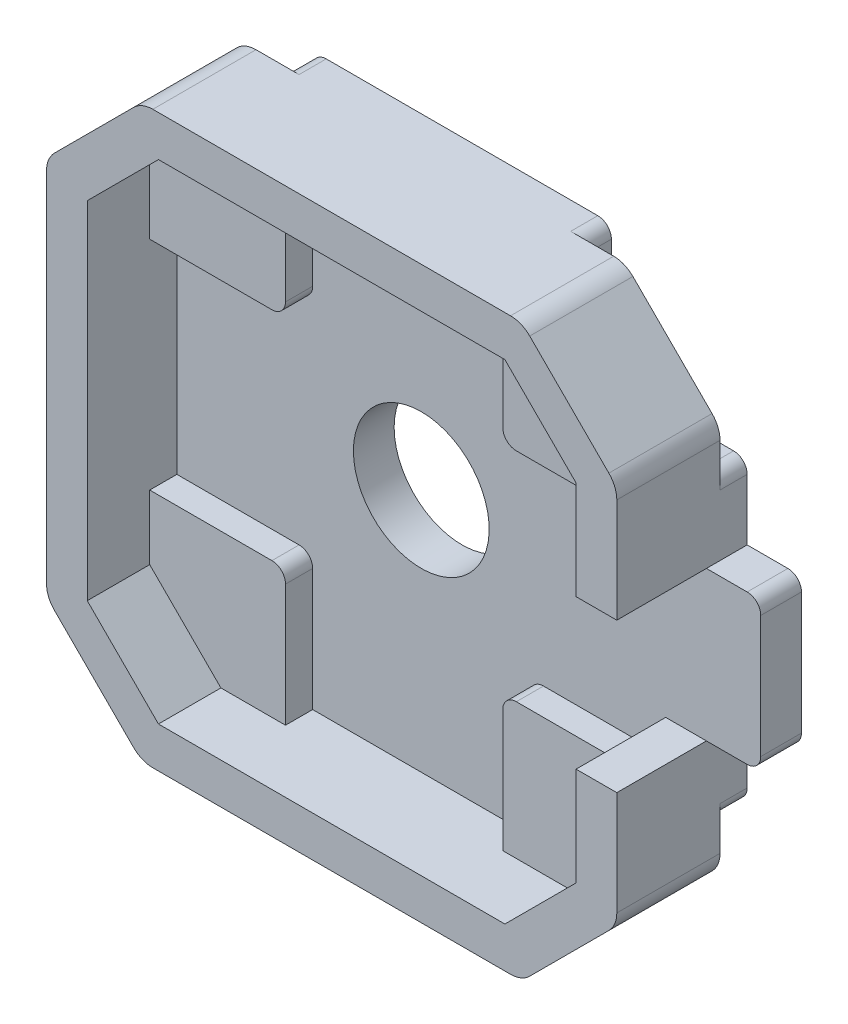
from build123d import *

# Parameters (mm, degrees)
SKETCH1_W           = 42
SKETCH1_H           = 42
BOSS_EXTRUDE1_DEPTH = 4.8
CUT_EXTRUDE1_REACH  = 33.212
CUT_EXTRUDE2_DEPTH  = 2
SKETCH4_W           = 3
SKETCH4_H           = 11
BOSS_EXTRUDE2_DEPTH = 4
SHELL1_T            = -3
CUT_EXTRUDE3_REACH  = 49.202
SKETCH5_W           = 6.6
SKETCH5_H           = 11
CUT_EXTRUDE4_REACH  = 36.032
SKETCH6_R           = 5
FILLET1_R           = 2
FILLET2_R           = 1


with BuildPart() as part:
    # Sketch1 → Boss-Extrude1 (new, symmetric)
    with BuildSketch(Plane.XY):
        Rectangle(SKETCH1_W, SKETCH1_H)
    extrude(amount=BOSS_EXTRUDE1_DEPTH, both=True)

    # Sketch2 → Cut-Extrude1 (cut, up to next)
    with BuildSketch(Plane.XY.offset(4.8), mode=Mode.PRIVATE) as cut_extrude1_sk1:
        Polygon((-21, 21), (-21, 14), (-14, 21), align=None)
    cut_extrude1_tool1 = extrude(cut_extrude1_sk1.sketch, amount=-CUT_EXTRUDE1_REACH, mode=Mode.PRIVATE) & part.part
    # Sketch2 → Cut-Extrude1 (cut, up to next)
    with BuildSketch(Plane.XY.offset(4.8), mode=Mode.PRIVATE) as cut_extrude1_sk2:
        Polygon((14, 21), (21, 21), (21, 14), align=None)
    cut_extrude1_tool2 = extrude(cut_extrude1_sk2.sketch, amount=-CUT_EXTRUDE1_REACH, mode=Mode.PRIVATE) & part.part
    # Sketch2 → Cut-Extrude1 (cut, up to next)
    with BuildSketch(Plane.XY.offset(4.8), mode=Mode.PRIVATE) as cut_extrude1_sk3:
        Polygon((21, -21), (21, -14), (14, -21), align=None)
    cut_extrude1_tool3 = extrude(cut_extrude1_sk3.sketch, amount=-CUT_EXTRUDE1_REACH, mode=Mode.PRIVATE) & part.part
    # Sketch2 → Cut-Extrude1 (cut, up to next)
    with BuildSketch(Plane.XY.offset(4.8), mode=Mode.PRIVATE) as cut_extrude1_sk4:
        Polygon((-14, -21), (-21, -21), (-21, -14), align=None)
    cut_extrude1_tool4 = extrude(cut_extrude1_sk4.sketch, amount=-CUT_EXTRUDE1_REACH, mode=Mode.PRIVATE) & part.part
    add(cut_extrude1_tool1.solids().sort_by_distance((-18.666667, 18.666667, 4.8))[0], mode=Mode.SUBTRACT)
    add(cut_extrude1_tool2.solids().sort_by_distance((18.666667, 18.666667, 4.8))[0], mode=Mode.SUBTRACT)
    add(cut_extrude1_tool3.solids().sort_by_distance((18.666667, -18.666667, 4.8))[0], mode=Mode.SUBTRACT)
    add(cut_extrude1_tool4.solids().sort_by_distance((-18.666667, -18.666667, 4.8))[0], mode=Mode.SUBTRACT)

    # Sketch3 → Cut-Extrude2 (cut)
    with BuildSketch(Plane(origin=(0, 0, -4.8), x_dir=(-1, 0, 0), z_dir=(0, 0, -1))):
        Polygon((-21, 14), (-21, 11), (-11, 11), (-11, 21), (-14, 21), align=None)
        Polygon((14, 21), (11, 21), (11, 11), (21, 11), (21, 14), align=None)
        Polygon((11, -11), (11, -21), (14, -21), (21, -14), (21, -11), align=None)
        Polygon((-11, -11), (-21, -11), (-21, -14), (-14, -21), (-11, -21), align=None)
    extrude(amount=-CUT_EXTRUDE2_DEPTH, mode=Mode.SUBTRACT)

    # Sketch4 → Boss-Extrude2 (add)
    with BuildSketch(Plane(origin=(21, 0, 0), x_dir=(0, 0, -1), z_dir=(1, 0, 0))):
        with Locations((3.3, 0)):
            Rectangle(SKETCH4_W, SKETCH4_H)
    extrude(amount=BOSS_EXTRUDE2_DEPTH)

    # Shell1
    shell1_openings = [part.faces().sort_by_distance(p)[0] for p in [
        (0, 0, 4.8),
    ]]
    offset(amount=SHELL1_T, openings=shell1_openings, kind=Kind.INTERSECTION)

    # Sketch5 → Cut-Extrude3 (cut, up to next)
    with BuildSketch(Plane(origin=(21, 0, 0), x_dir=(0, 0, -1), z_dir=(1, 0, 0)), mode=Mode.PRIVATE) as cut_extrude3_sk1:
        with Locations((-1.5, 0)):
            Rectangle(SKETCH5_W, SKETCH5_H)
    cut_extrude3_tool1 = extrude(cut_extrude3_sk1.sketch, amount=-CUT_EXTRUDE3_REACH, mode=Mode.PRIVATE) & part.part
    add(cut_extrude3_tool1.solids().sort_by_distance((21, 0, 1.5))[0], mode=Mode.SUBTRACT)

    # Sketch6 → Cut-Extrude4 (cut, up to next)
    with BuildSketch(Plane(origin=(0, 0, -4.8), x_dir=(-1, 0, 0), z_dir=(0, 0, -1)), mode=Mode.PRIVATE) as cut_extrude4_sk1:
        Circle(SKETCH6_R)
    cut_extrude4_tool1 = extrude(cut_extrude4_sk1.sketch, amount=-CUT_EXTRUDE4_REACH, mode=Mode.PRIVATE) & part.part
    add(cut_extrude4_tool1.solids().sort_by_distance((0, 0, -4.8))[0], mode=Mode.SUBTRACT)

    # Fillet1
    fillet1_edges = [part.edges().sort_by_distance(p)[0] for p in [
        (-14, -21, 1),
        (-21, -14, 1),
        (21, -14, 1),
        (14, -21, 1),
        (14, 21, 1),
        (21, 14, 1),
        (-21, 14, 1),
        (-14, 21, 1),
    ]]
    fillet(fillet1_edges, radius=FILLET1_R)

    # Fillet2
    fillet2_edges = [part.edges().sort_by_distance(p)[0] for p in [
        (25, 5.5, -3.3),
        (25, -5.5, -3.3),
        (-8, -8, -0.8),
        (8, -8, -0.8),
        (8, 8, -0.8),
        (-8, 8, -0.8),
        (21, -11, -3.8),
        (11, -21, -3.8),
        (-11, -21, -3.8),
        (-21, -11, -3.8),
        (-21, 11, -3.8),
        (-11, 21, -3.8),
        (11, 21, -3.8),
        (21, 11, -3.8),
    ]]
    fillet(fillet2_edges, radius=FILLET2_R)


solid = part.part
